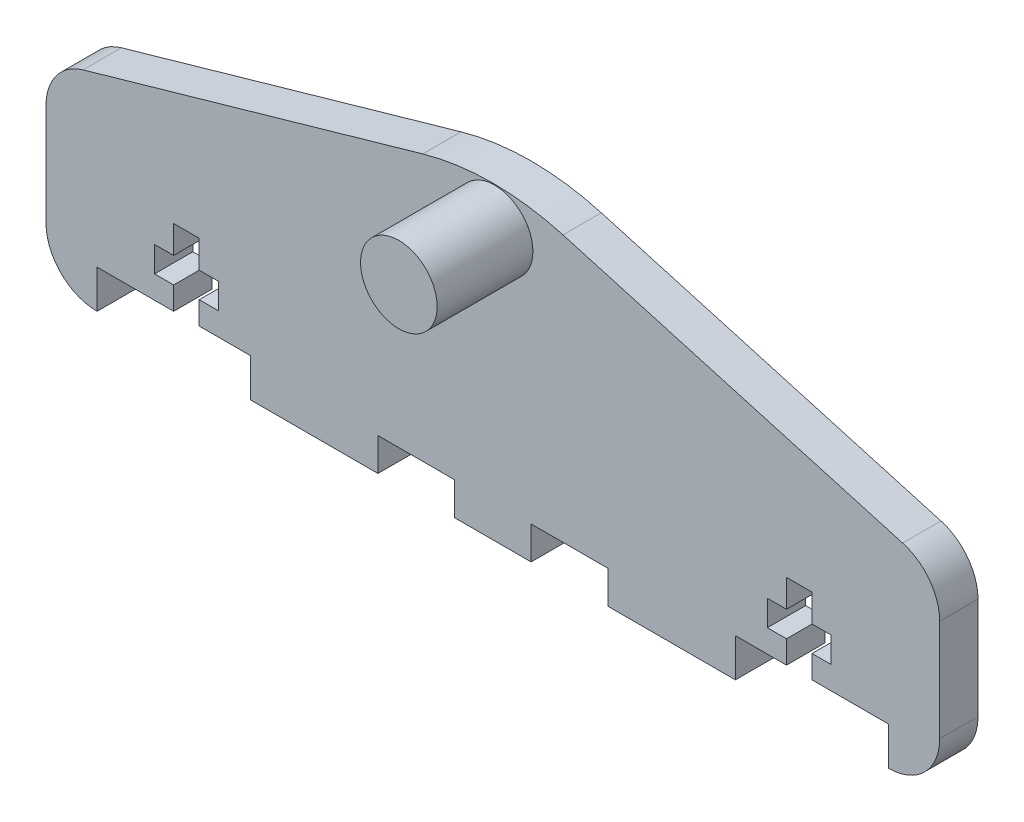
from build123d import *

# Parameters (mm, degrees)
ESQUISSE1_R             = 5
BOSS_EXTRU_1_DEPTH      = 15
ESQUISSE2_W             = 30
ESQUISSE2_H             = 12.881717487
ENL_V_MAT_EXTRU_1_DEPTH = 15
ESQUISSE3_W             = 20
ESQUISSE3_H             = 15
ENL_V_MAT_EXTRU_2_DEPTH = 15
ESQUISSE5_R             = 15
BOSS_EXTRU_2_DEPTH      = 37.5


with BuildPart() as part:
    # Esquisse1 → Boss.-Extru.1 (new body)
    with BuildSketch(Plane.XY):
        with BuildLine():
            Line((-160.494422558, 41.644450698), (-27.47211279, 79.650824917))
            ThreePointArc((-27.47211279, 79.650824917), (0, 83.498430153), (27.47211279, 79.650824917))
            Line((27.47211279, 79.650824917), (160.494422558, 41.644450698))
            ThreePointArc((160.494422558, 41.644450698), (170.966972962, 34.457882008), (175, 22.413971745))
            Line((175, 22.413971745), (175, -17.5))
            ThreePointArc((175, -17.5), (169.142135624, -31.642135624), (155, -37.5))
            Line((155, -37.5), (-155, -37.5))
            ThreePointArc((-155, -37.5), (-169.142135624, -31.642135624), (-175, -17.5))
            Line((-175, -17.5), (-175, 22.413971745))
            ThreePointArc((-175, 22.413971745), (-170.966972962, 34.457882008), (-160.494422558, 41.644450698))
        make_face()
        with Locations((0, 68.16509682)):
            Circle(ESQUISSE1_R, mode=Mode.SUBTRACT)
    extrude(amount=BOSS_EXTRU_1_DEPTH)

    # Esquisse2 → Enlèv. mat.-Extru.1 (cut)
    with BuildSketch(Plane.XY.offset(15)):
        Polygon((95, -37.5), (115, -37.5), (125, -37.5), (135, -37.5), (135, -22.5), (125, -22.5), (125, -13.549697849), (132.5, -13.549697849), (132.5, -3.549697849), (125, -3.549697849), (125, 7.276030806), (115, 7.276030806), (115, -3.549697849), (107.5, -3.549697849), (107.5, -13.549697849), (115, -13.549697849), (115, -22.5), (95, -22.5), align=None)
        with Locations((30, -31.059141256)):
            Rectangle(ESQUISSE2_W, ESQUISSE2_H)
        with Locations((-30, -31.059141256)):
            Rectangle(ESQUISSE2_W, ESQUISSE2_H)
        Polygon((-115, -37.5), (-95, -37.5), (-95, -22.5), (-115, -22.5), (-115, -13.549697849), (-107.5, -13.549697849), (-107.5, -3.549697849), (-115, -3.549697849), (-115, 7.276030806), (-125, 7.276030806), (-125, -3.549697849), (-132.5, -3.549697849), (-132.5, -13.549697849), (-125, -13.549697849), (-125, -22.5), (-135, -22.5), (-135, -37.5), (-125, -37.5), align=None)
    extrude(amount=-ENL_V_MAT_EXTRU_1_DEPTH, mode=Mode.SUBTRACT)

    # Esquisse3 → Enlèv. mat.-Extru.2 (cut)
    with BuildSketch(Plane(origin=(0, 0, 0), x_dir=(-1, 0, 0), z_dir=(0, 0, -1))):
        with Locations((145, -30)):
            Rectangle(ESQUISSE3_W, ESQUISSE3_H)
        with Locations((-145, -30)):
            Rectangle(ESQUISSE3_W, ESQUISSE3_H)
    extrude(amount=-ENL_V_MAT_EXTRU_2_DEPTH, mode=Mode.SUBTRACT)

    # Esquisse5 → Boss.-Extru.2 (add)
    with BuildSketch(Plane.XY.offset(15)):
        with Locations((0.685853551, 68.16509682)):
            Circle(ESQUISSE5_R)
    extrude(amount=BOSS_EXTRU_2_DEPTH)


solid = part.part
